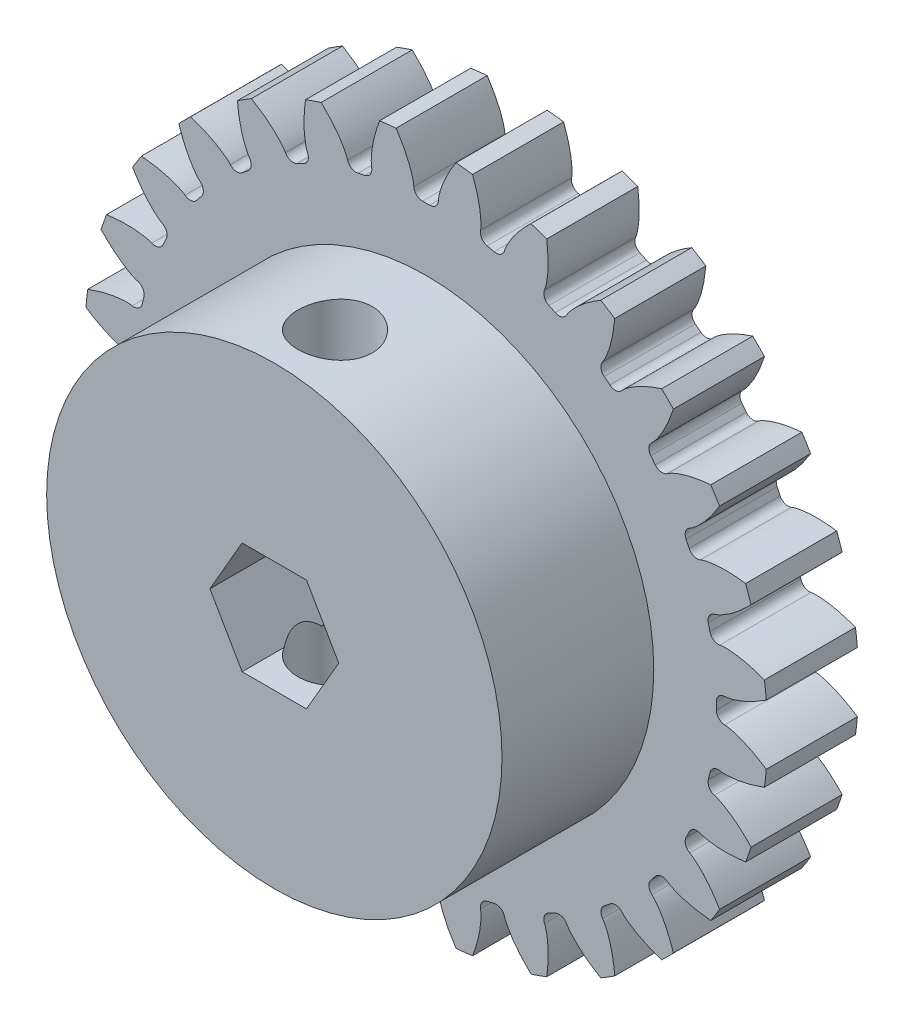
from build123d import *

# Parameters (mm, degrees)
SKETCH_1_R               = 22.5
LASHENA_DEPTH            = 6
CUT_EXTRUDEA_DEPTH       = 6
WWW_KYTOOL_CN_COUNT      = 28
SKETCH_3_R               = 15
EXTRUDE_2_DEPTH          = 10
CUT_EXTRUDE_2_DEPTH      = 34.237086681
CUT_EXTRUDE_3_DEPTH      = 38.933450235
CUT_EXTRUDE_3_DEPTH_BACK = 38.933450235
SKETCH_5_R               = 2.45


with BuildPart() as part:
    # 草图1 → LaShenA (new body)
    with BuildSketch(Plane.XY):
        Circle(SKETCH_1_R)
    extrude(amount=LASHENA_DEPTH)

    # SketchA → Cut-ExtrudeA (cut)
    with BuildSketch(Plane.XY.offset(6)):
        with BuildLine():
            ThreePointArc((0.234138598, 19.123566721), (0, 19.125), (-0.234138598, 19.123566721))
            ThreePointArc((-0.234138598, 19.123566721), (-0.632858155, 19.279472379), (-0.810587071, 19.668954461))
            add(Edge.make_bspline(
                [(-0.810587071, 19.668954461), (-0.811276616, 19.684936652), (-0.81317498, 19.719453832), (-0.817569835, 19.768411607), (-0.824425368, 19.819756361), (-0.833061084, 19.875035748), (-0.845342439, 19.942307282), (-0.861816355, 20.021426669), (-0.883104377, 20.112214103), (-0.909793699, 20.214471551), (-0.942473771, 20.327977062), (-0.981723079, 20.452486974), (-1.028112445, 20.587735536), (-1.082203, 20.7334354), (-1.144545861, 20.889277864), (-1.215681294, 21.054933221), (-1.296138039, 21.23005111), (-1.386432609, 21.414260892), (-1.487068607, 21.607172046), (-1.598536061, 21.80837459), (-1.721310749, 22.017439519), (-1.855853614, 22.233919266), (-2.00260991, 22.457348191), (-2.219865615, 22.770686359), (-2.395497954, 23.004282398), (-2.518818839, 23.160355677)],
                knots=[0.124919814, 0.124919814, 0.124919814, 0.124919814, 0.135577783, 0.148023853, 0.157705402, 0.170153106, 0.185366967, 0.203346984, 0.224093156, 0.247605486, 0.273883971, 0.302928612, 0.33473941, 0.369316364, 0.406659474, 0.446768741, 0.489644164, 0.535285743, 0.583693478, 0.634867369, 0.688807417, 0.745513621, 0.804985981, 0.867224498, 1, 1, 1, 1], degree=3))
            ThreePointArc((-2.518818839, 23.160355677), (0, 23.2969209), (2.518818839, 23.160355677))
            add(Edge.make_bspline(
                [(0.810587071, 19.668954461), (0.811276616, 19.684936652), (0.81317498, 19.719453832), (0.817569835, 19.768411607), (0.824425368, 19.819756361), (0.833061084, 19.875035748), (0.845342439, 19.942307282), (0.861816355, 20.021426669), (0.883104377, 20.112214103), (0.909793699, 20.214471551), (0.942473771, 20.327977062), (0.981723079, 20.452486974), (1.028112445, 20.587735536), (1.082203, 20.7334354), (1.144545861, 20.889277864), (1.215681294, 21.054933221), (1.296138039, 21.23005111), (1.386432609, 21.414260892), (1.487068607, 21.607172046), (1.598536061, 21.80837459), (1.721310749, 22.017439519), (1.855853614, 22.233919266), (2.00260991, 22.457348191), (2.219865615, 22.770686359), (2.395497954, 23.004282398), (2.518818839, 23.160355677)],
                knots=[0.124919814, 0.124919814, 0.124919814, 0.124919814, 0.135577783, 0.148023853, 0.157705402, 0.170153106, 0.185366967, 0.203346984, 0.224093156, 0.247605486, 0.273883971, 0.302928612, 0.33473941, 0.369316364, 0.406659474, 0.446768741, 0.489644164, 0.535285743, 0.583693478, 0.634867369, 0.688807417, 0.745513621, 0.804985981, 0.867224498, 1, 1, 1, 1], degree=3))
            ThreePointArc((0.810587071, 19.668954461), (0.632858155, 19.279472379), (0.234138598, 19.123566721))
        make_face()
    cut_extrudea = extrude(amount=-CUT_EXTRUDEA_DEPTH, mode=Mode.SUBTRACT)

    # www.KYTool.cn: Cut-ExtrudeA ×28 about axis
    www_kytool_cn_axis = Axis((0, 0, -88.99), (0, 0, 1))
    for i in range(1, WWW_KYTOOL_CN_COUNT):
        add(cut_extrudea.rotate(www_kytool_cn_axis, i * 360 / WWW_KYTOOL_CN_COUNT), mode=Mode.SUBTRACT)

    # 草图3 → 凸台-拉伸2 (add)
    with BuildSketch(Plane.XY.offset(6)):
        Circle(SKETCH_3_R)
        Polygon((4.243524479, 0), (2.121762239, 3.675), (-2.121762239, 3.675), (-4.243524479, 0), (-2.121762239, -3.675), (2.121762239, -3.675), align=None, mode=Mode.SUBTRACT)
    extrude(amount=EXTRUDE_2_DEPTH)

    # 草图4 → 切除-拉伸2 (cut, through all)
    with BuildSketch(Plane.XY.offset(6)):
        Polygon((2.121762239, -3.675), (4.243524479, 0), (2.121762239, 3.675), (-2.121762239, 3.675), (-4.243524479, 0), (-2.121762239, -3.675), align=None)
    extrude(amount=-CUT_EXTRUDE_2_DEPTH, mode=Mode.SUBTRACT)

    # 草图5 → 切除-拉伸3 (cut, two sides: drawn at the far end of the back side and taken through both)
    with BuildSketch(Plane.XZ.offset(-3.675).offset(-CUT_EXTRUDE_3_DEPTH_BACK)):
        with Locations((0, 12)):
            Circle(SKETCH_5_R)
    extrude(amount=CUT_EXTRUDE_3_DEPTH + CUT_EXTRUDE_3_DEPTH_BACK, mode=Mode.SUBTRACT)


solid = part.part
